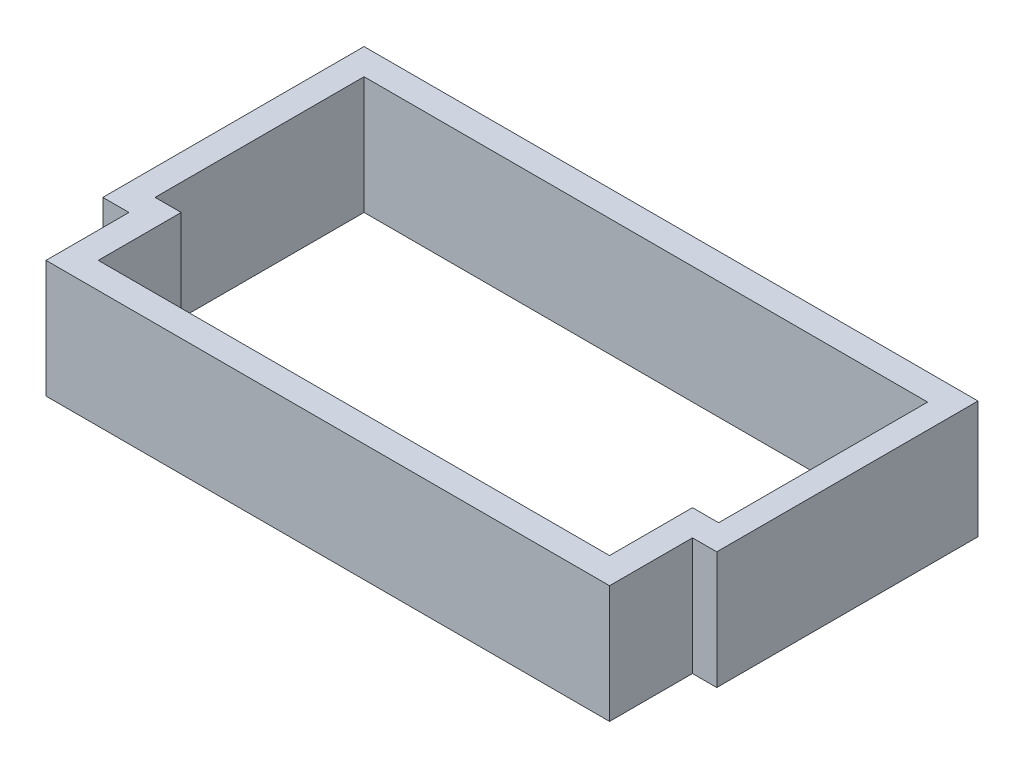
from build123d import *

# Parameters (mm, degrees)
BOSS_EXTRUDE1_DEPTH = 4.5


with BuildPart() as part:
    # Sketch1 → Boss-Extrude1 (new body)
    with BuildSketch(Plane(origin=(0, 0, 0), x_dir=(1, 0, 0), z_dir=(0, 1, 0))):
        Polygon((11.714410298, 5), (11.714410298, -5), (10.785589702, -5), (10.785589702, -8.175), (-10.785589702, -8.175), (-10.785589702, -5), (-11.785589702, -5), (-11.785589702, 5), align=None)
        Polygon((10.785589702, 4), (10.785589702, -4), (9.785589702, -4), (9.785589702, -7.175), (-9.785589702, -7.175), (-9.785589702, -4), (-10.785589702, -4), (-10.785589702, 4), align=None, mode=Mode.SUBTRACT)
    extrude(amount=BOSS_EXTRUDE1_DEPTH)


solid = part.part
